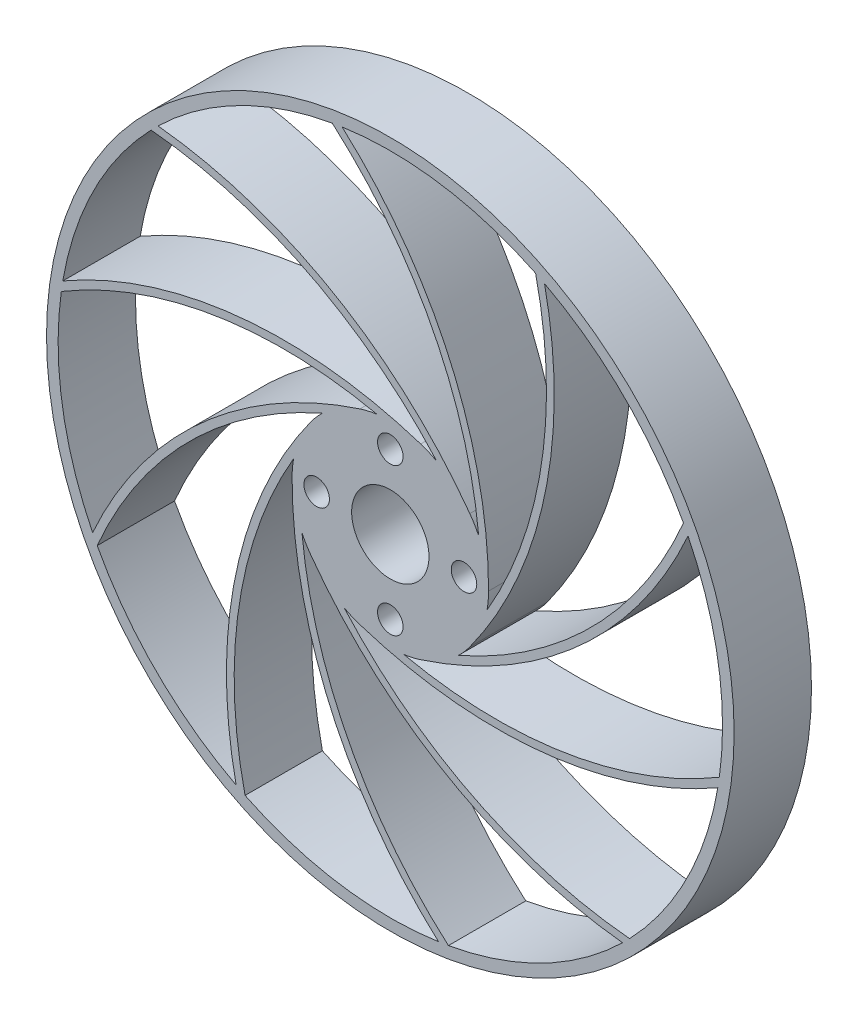
from build123d import *

# Parameters (mm, degrees)
SKETCH1_R           = 44.45
SKETCH1_R_2         = 42.95
SKETCH1_R_3         = 12.7
SKETCH1_R_4         = 1.65
SKETCH1_R_5         = 5
BOSS_EXTRUDE1_DEPTH = 10


with BuildPart() as part:
    # Sketch1 → Boss-Extrude1 (new body)
    # profile 1 of 12: a face of its own
    with BuildSketch(Plane.XY):
        Circle(SKETCH1_R)
        Circle(SKETCH1_R_2, mode=Mode.SUBTRACT)
    # profile 2 of 12: a face of its own
    with BuildSketch(Plane.XY):
        with BuildLine():
            ThreePointArc((-1.742936184, 12.579832012), (1.119230316, 12.650585896), (3.924515829, 12.078417757))
            ThreePointArc((3.924515829, 12.078417757), (-19.72755965, 14.560574413), (-42.342066264, 7.20082804))
            ThreePointArc((-42.342066264, 7.20082804), (-42.445514325, 6.563597619), (-42.539372889, 5.924884318))
            ThreePointArc((-42.539372889, 5.924884318), (-22.775826214, 13.143048835), (-1.742936184, 12.579832012))
        make_face()
    # profile 3 of 12: a face of its own
    with BuildSketch(Plane.XY):
        with BuildLine():
            ThreePointArc((-8.804304726, 9.1528257), (-6.530351476, 10.892406052), (-3.924515829, 12.078417757))
            ThreePointArc((-3.924515829, 12.078417757), (-24.518421919, 0.184183522), (-38.487991711, -19.062449843))
            ThreePointArc((-38.487991711, -19.062449843), (-38.197128306, -19.638785328), (-37.897635221, -20.210683923))
            ThreePointArc((-37.897635221, -20.210683923), (-26.151320743, -2.754344892), (-8.804304726, 9.1528257))
        make_face()
    # profile 4 of 12: a face of its own
    with BuildSketch(Plane.XY):
        with BuildLine():
            ThreePointArc((-12.50272811, 2.229751063), (-11.685560963, 4.973697316), (-10.274515829, 7.464872704))
            ThreePointArc((-10.274515829, 7.464872704), (-19.944080366, -14.262559214), (-19.932812483, -38.044519796))
            ThreePointArc((-19.932812483, -38.044519796), (-19.358737547, -38.339819778), (-18.780288992, -38.626457842))
            ThreePointArc((-18.780288992, -38.626457842), (-19.537899599, -17.599672487), (-12.50272811, 2.229751063))
        make_face()
    # profile 5 of 12: a face of its own
    with BuildSketch(Plane.XY):
        with BuildLine():
            ThreePointArc((7.510489314, -42.28823773), (-5.461664877, -25.722523382), (-11.425534308, -5.545012694))
            ThreePointArc((-11.425534308, -5.545012694), (-12.377283339, -2.844794745), (-12.7, 0))
            ThreePointArc((-12.7, 0), (-7.751777987, -23.261489097), (6.236023622, -42.494876272))
            ThreePointArc((6.236023622, -42.494876272), (6.874032975, -42.396346195), (7.510489314, -42.28823773))
        make_face()
    # profile 6 of 12: a face of its own
    with BuildSketch(Plane.XY):
        with BuildLine():
            ThreePointArc((30.932515974, -29.797348129), (10.700740193, -24.020244623), (-5.98417474, -11.201770069))
            ThreePointArc((-5.98417474, -11.201770069), (-8.341304168, -9.576671905), (-10.274515829, -7.464872704))
            ThreePointArc((-10.274515829, -7.464872704), (7.401440109, -23.375320774), (30.022910658, -30.71363436))
            ThreePointArc((30.022910658, -30.71363436), (30.481156541, -30.258909364), (30.932515974, -29.797348129))
        make_face()
    # profile 7 of 12: a face of its own
    with BuildSketch(Plane.XY):
        with BuildLine():
            ThreePointArc((42.539372889, -5.924884318), (22.775826214, -13.143048835), (1.742936184, -12.579832012))
            ThreePointArc((1.742936184, -12.579832012), (-1.119230316, -12.650585896), (-3.924515829, -12.078417757))
            ThreePointArc((-3.924515829, -12.078417757), (19.72755965, -14.560574413), (42.342066264, -7.20082804))
            ThreePointArc((42.342066264, -7.20082804), (42.445514325, -6.563597619), (42.539372889, -5.924884318))
        make_face()
    # profile 8 of 12: a face of its own
    with BuildSketch(Plane.XY):
        with BuildLine():
            ThreePointArc((37.897635221, 20.210683923), (26.151320743, 2.754344892), (8.804304726, -9.1528257))
            ThreePointArc((8.804304726, -9.1528257), (6.530351476, -10.892406052), (3.924515829, -12.078417757))
            ThreePointArc((3.924515829, -12.078417757), (24.518421919, -0.184183522), (38.487991711, 19.062449843))
            ThreePointArc((38.487991711, 19.062449843), (38.197128306, 19.638785328), (37.897635221, 20.210683923))
        make_face()
    # profile 9 of 12: a face of its own
    with BuildSketch(Plane.XY):
        with BuildLine():
            ThreePointArc((18.780288992, 38.626457842), (19.537899599, 17.599672487), (12.50272811, -2.229751063))
            ThreePointArc((12.50272811, -2.229751063), (11.685560963, -4.973697316), (10.274515829, -7.464872704))
            ThreePointArc((10.274515829, -7.464872704), (19.944080366, 14.262559214), (19.932812483, 38.044519796))
            ThreePointArc((19.932812483, 38.044519796), (19.358737547, 38.339819778), (18.780288992, 38.626457842))
        make_face()
    # profile 10 of 12: a face of its own
    with BuildSketch(Plane.XY):
        with BuildLine():
            ThreePointArc((11.425534308, 5.545012694), (12.377283339, 2.844794745), (12.7, 0))
            ThreePointArc((12.7, 0), (7.751777987, 23.261489097), (-6.236023622, 42.494876272))
            ThreePointArc((-6.236023622, 42.494876272), (-6.874032975, 42.396346195), (-7.510489314, 42.28823773))
            ThreePointArc((-7.510489314, 42.28823773), (5.461664877, 25.722523382), (11.425534308, 5.545012694))
        make_face()
    # profile 11 of 12: a face of its own
    with BuildSketch(Plane.XY):
        with BuildLine():
            ThreePointArc((5.98417474, 11.201770069), (8.341304168, 9.576671905), (10.274515829, 7.464872704))
            ThreePointArc((10.274515829, 7.464872704), (-7.401440109, 23.375320774), (-30.022910658, 30.71363436))
            ThreePointArc((-30.022910658, 30.71363436), (-30.481156541, 30.258909364), (-30.932515974, 29.797348129))
            ThreePointArc((-30.932515974, 29.797348129), (-10.700740193, 24.020244623), (5.98417474, 11.201770069))
        make_face()
    # profile 12 of 12: a face of its own
    with BuildSketch(Plane.XY):
        Circle(SKETCH1_R_3)
        with Locations((-9.525, 0)):
            Circle(SKETCH1_R_4, mode=Mode.SUBTRACT)
        with Locations((9.525, 0)):
            Circle(SKETCH1_R_4, mode=Mode.SUBTRACT)
        with Locations((0, -9.525)):
            Circle(SKETCH1_R_4, mode=Mode.SUBTRACT)
        with Locations((0, 9.525)):
            Circle(SKETCH1_R_4, mode=Mode.SUBTRACT)
        Circle(SKETCH1_R_5, mode=Mode.SUBTRACT)
    extrude(amount=BOSS_EXTRUDE1_DEPTH)


solid = part.part
